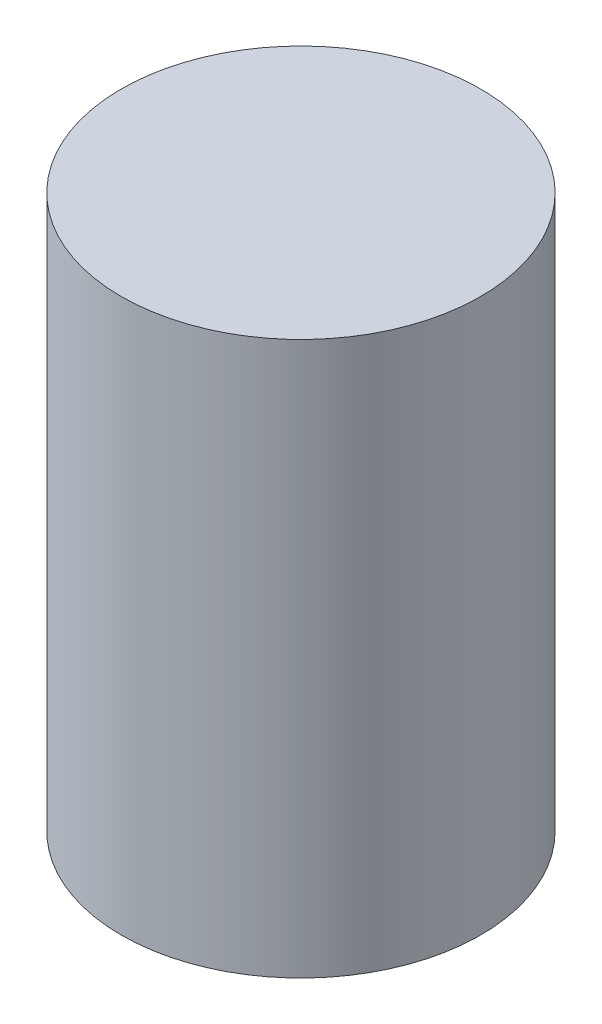
from build123d import *

# Parameters (mm, degrees)
SKETCH1_R           = 2.6
BOSS_EXTRUDE1_DEPTH = 8


with BuildPart() as part:
    # Sketch1 → Boss-Extrude1 (new body)
    with BuildSketch(Plane(origin=(0, 0, 0), x_dir=(1, 0, 0), z_dir=(0, 1, 0))):
        with Locations(Location((0, 0, 0), (0, 0, 270))):
            Circle(SKETCH1_R)
    extrude(amount=BOSS_EXTRUDE1_DEPTH)


solid = part.part
